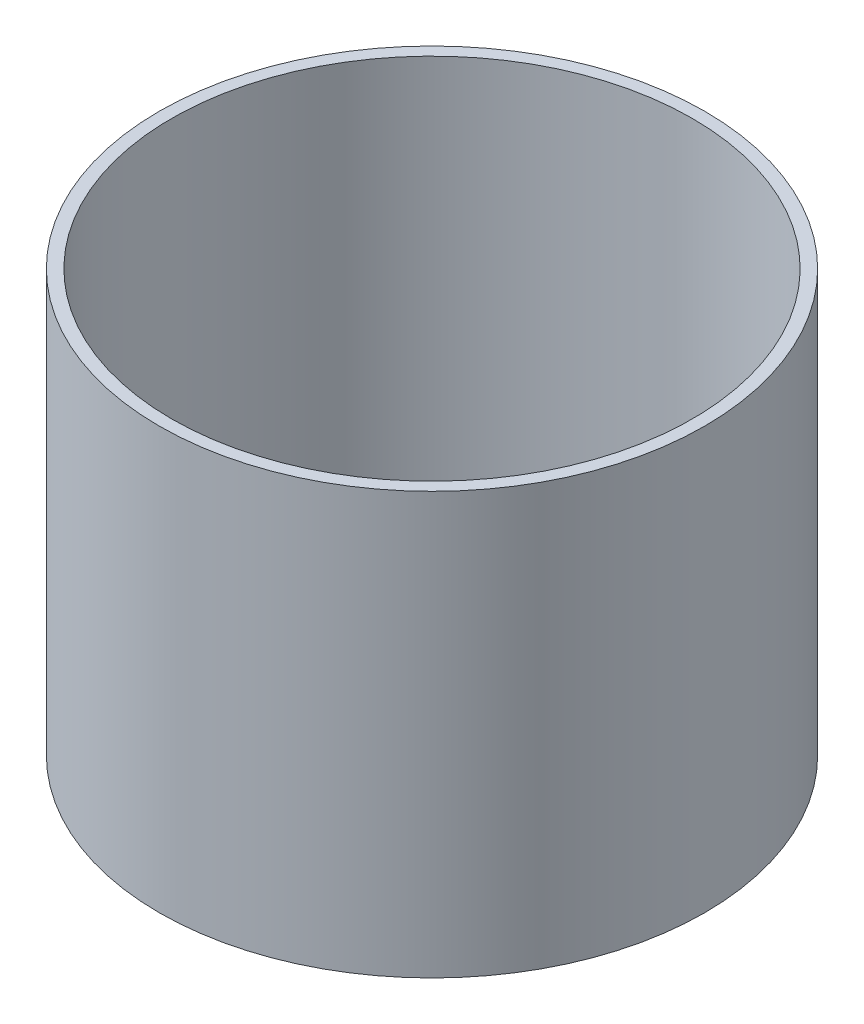
from build123d import *

# Parameters (mm, degrees)
SKETCH1_R           = 11
SKETCH1_R_2         = 10.5
BOSS_EXTRUDE1_DEPTH = 17


with BuildPart() as part:
    # Sketch1 → Boss-Extrude1 (new body)
    with BuildSketch(Plane(origin=(0, 0, 0), x_dir=(1, 0, 0), z_dir=(0, 1, 0))):
        with Locations(Location((0, 0, 0), (0, 0, 270))):
            Circle(SKETCH1_R)
        with Locations(Location((0, 0, 0), (0, 0, 270))):
            Circle(SKETCH1_R_2, mode=Mode.SUBTRACT)
    extrude(amount=BOSS_EXTRUDE1_DEPTH)


solid = part.part
